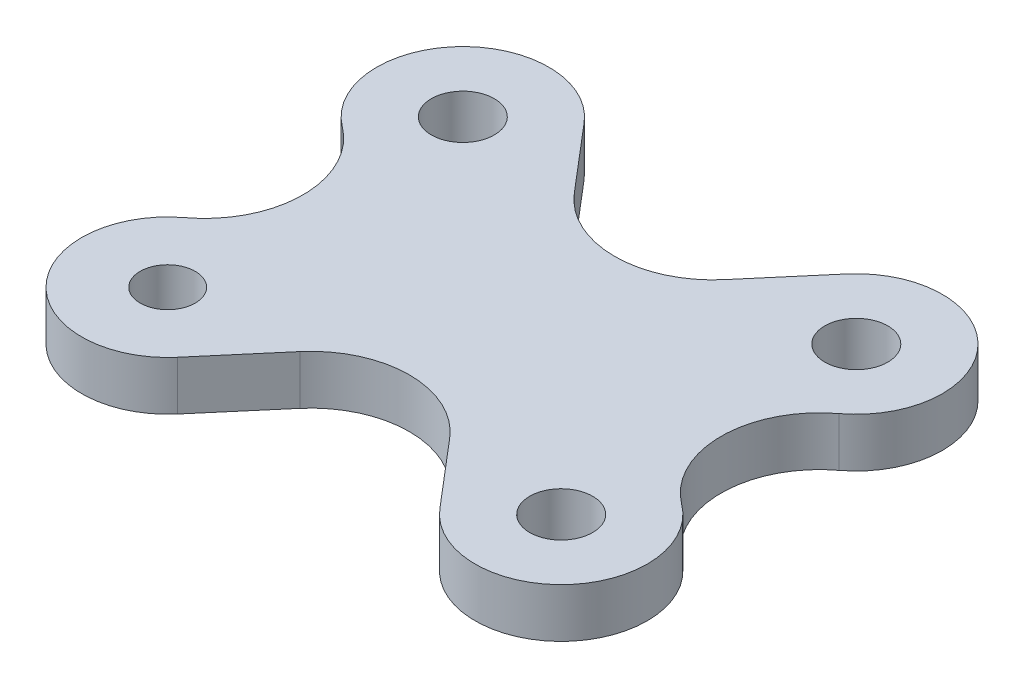
from build123d import *

# Parameters (mm, degrees)
BOSS_EXTRUDE1_DEPTH = 3.175
FILLET1_R           = 6.35
SKETCH2_R           = 2.032
SKETCH2_R_2         = 1.778
CUT_EXTRUDE1_DEPTH  = 24.8917433


with BuildPart() as part:
    # Sketch1 → Boss-Extrude1 (new body)
    with BuildSketch(Plane(origin=(0, 0, 0), x_dir=(1, 0, 0), z_dir=(0, 1, 0))):
        with BuildLine():
            Line((-8.468627029, -13.126027192), (0, -3.175))
            Line((0, -3.175), (8.468627029, -13.126027192))
            ThreePointArc((8.468627029, -13.126027192), (17.244713502, -12.721481385), (14.65849127, -4.325362897))
            Line((14.65849127, -4.325362897), (3.175, 0))
            Line((3.175, 0), (14.65849127, 4.325362897))
            ThreePointArc((14.65849127, 4.325362897), (17.244713502, 12.721481385), (8.468627029, 13.126027192))
            Line((8.468627029, 13.126027192), (0, 3.175))
            Line((0, 3.175), (-8.468627029, 13.126027192))
            ThreePointArc((-8.468627029, 13.126027192), (-17.244713502, 12.721481385), (-14.65849127, 4.325362897))
            Line((-14.65849127, 4.325362897), (-3.175, 0))
            Line((-3.175, 0), (-14.65849127, -4.325362897))
            ThreePointArc((-14.65849127, -4.325362897), (-17.244713502, -12.721481385), (-8.468627029, -13.126027192))
        make_face()
    extrude(amount=BOSS_EXTRUDE1_DEPTH)

    # Fillet1
    fillet1_edges = [part.edges().sort_by_distance(p)[0] for p in [
        (0, 1.5875, -3.175),
        (-3.175, 1.5875, 0),
        (3.175, 1.5875, 0),
        (0, 1.5875, 3.175),
    ]]
    fillet(fillet1_edges, radius=FILLET1_R)

    # Sketch2 → Cut-Extrude1 (cut, through all)
    with BuildSketch(Plane(origin=(0, 3.175, 0), x_dir=(1, 0, 0), z_dir=(0, 1, 0))):
        with Locations(Location((-12.7, 9.525, 0), (0, 0, 270))):
            Circle(SKETCH2_R)
        with Locations(Location((12.7, 9.525, 0), (0, 0, 270))):
            Circle(SKETCH2_R)
        with Locations(Location((12.7, -9.525, 0), (0, 0, 270))):
            Circle(SKETCH2_R)
        with Locations(Location((-12.7, -9.525, 0), (0, 0, 270))):
            Circle(SKETCH2_R_2)
    extrude(amount=-CUT_EXTRUDE1_DEPTH, mode=Mode.SUBTRACT)


solid = part.part
